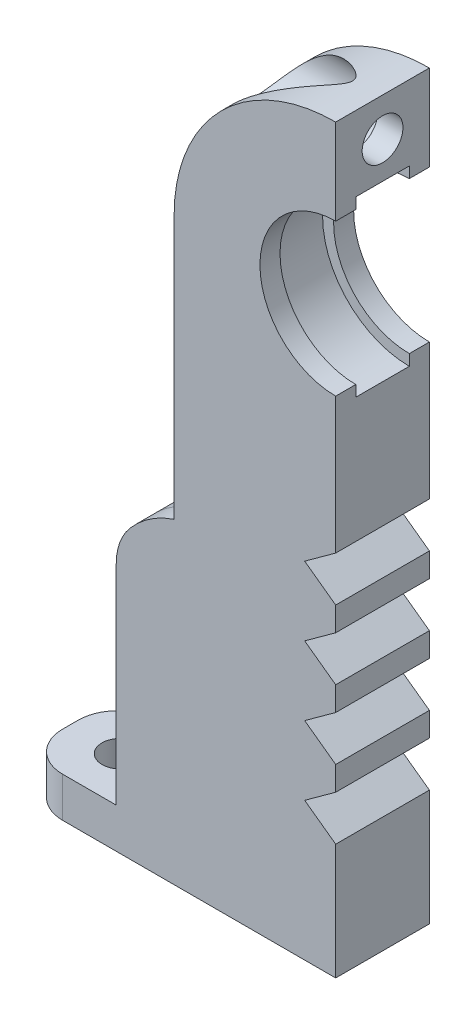
from build123d import *

# Parameters (mm, degrees)
BOSS_EXTRUDE1_DEPTH = 3.43
BOSS_EXTRUDE3_START = 2.57
BOSS_EXTRUDE3_DEPTH = 2.57
SKETCH6_R           = 2.41
CUT_EXTRUDE1_DEPTH  = 99.472542366
SKETCH7_R           = 2.61
CUT_EXTRUDE2_DEPTH  = 85.51564648
BOSS_EXTRUDE5_DEPTH = 2.57
FILLET4_R           = 5
SKETCH16_R          = 4.55
CUT_EXTRUDE5_DEPTH  = 84.028410807


with BuildPart() as part:
    # Sketch2 → Boss-Extrude1 (new, symmetric)
    with BuildSketch(Plane.XY):
        with BuildLine():
            Line((0, -11.11), (0, -27.11))
            Line((0, -27.11), (-3.97, -29.99))
            Line((-3.97, -29.99), (0, -32.87))
            Line((0, -32.87), (0, -35.95))
            Line((0, -35.95), (-3.97, -38.83))
            Line((-3.97, -38.83), (0, -41.71))
            Line((0, -41.71), (0, -44.79))
            Line((0, -44.79), (-3.97, -47.67))
            Line((-3.97, -47.67), (0, -50.55))
            Line((0, -50.55), (0, -53.63))
            Line((0, -53.63), (-3.97, -56.51))
            Line((-3.97, -56.51), (0, -59.39))
            Line((0, -59.39), (0, -74.23))
            Line((0, -74.23), (-39.96, -74.23))
            Line((-39.96, -74.23), (-39.96, -69.11))
            Line((-39.96, -69.11), (-28.1, -69.11))
            Line((-28.1, -69.11), (-28.1, -42.31))
            ThreePointArc((-28.1, -42.31), (-27.646434109, -39.757329931), (-26.341261949, -37.517157588))
            ThreePointArc((-26.341261949, -37.517157588), (-23.778435094, -35.222062226), (-20.69, -33.706439294))
            Line((-20.69, -33.706439294), (-20.69, 0))
            ThreePointArc((-20.69, 0), (-14.630039303, 14.630039303), (0, 20.69))
            Line((0, 20.69), (0, 11.11))
            ThreePointArc((0, 11.11), (-11.11, 0), (0, -11.11))
        make_face()
    extrude(amount=BOSS_EXTRUDE1_DEPTH, both=True)

    # Sketch4 → Boss-Extrude3 (add)
    with BuildSketch(Plane.XY.offset(3.43).offset(BOSS_EXTRUDE3_START)):
        with BuildLine():
            Line((-39.96, -69.11), (-39.96, -74.23))
            Line((-39.96, -74.23), (0, -74.23))
            Line((0, -74.23), (0, -59.39))
            Line((0, -59.39), (-3.97, -56.51))
            Line((-3.97, -56.51), (0, -53.63))
            Line((0, -53.63), (0, -50.55))
            Line((0, -50.55), (-3.97, -47.67))
            Line((-3.97, -47.67), (0, -44.79))
            Line((0, -44.79), (0, -41.71))
            Line((0, -41.71), (-3.97, -38.83))
            Line((-3.97, -38.83), (0, -35.95))
            Line((0, -35.95), (0, -32.87))
            Line((0, -32.87), (-3.97, -29.99))
            Line((-3.97, -29.99), (0, -27.11))
            Line((0, -27.11), (0, -9.7))
            ThreePointArc((0, -9.7), (-9.7, 0), (0, 9.7))
            Line((0, 9.7), (0, 20.69))
            ThreePointArc((0, 20.69), (-14.630039303, 14.630039303), (-20.69, 0))
            Line((-20.69, 0), (-20.69, -33.707281395))
            ThreePointArc((-20.69, -33.707281395), (-23.776797611, -35.221620619), (-26.33894333, -37.514425035))
            ThreePointArc((-26.33894333, -37.514425035), (-27.645816634, -39.755647839), (-28.1, -42.31))
            Line((-28.1, -42.31), (-28.1, -69.11))
            Line((-28.1, -69.11), (-39.96, -69.11))
        make_face()
    extrude(amount=-BOSS_EXTRUDE3_DEPTH)

    # Sketch6 → Cut-Extrude1 (cut, through all)
    with BuildSketch(Plane(origin=(0, -69.11, 0), x_dir=(1, 0, 0), z_dir=(0, 1, 0))):
        with Locations(Location((-33.51, 0, 0), (0, 0, 270))):
            Circle(SKETCH6_R)
    extrude(amount=-CUT_EXTRUDE1_DEPTH, mode=Mode.SUBTRACT)

    # Sketch7 → Cut-Extrude2 (cut, through all)
    with BuildSketch(Plane(origin=(0, 0, 0), x_dir=(0, 0, -1), z_dir=(1, 0, 0))):
        with Locations((0, 15.78)):
            Circle(SKETCH7_R)
    extrude(amount=-CUT_EXTRUDE2_DEPTH, mode=Mode.SUBTRACT)

    # Sketch15 → Boss-Extrude5 (add)
    with BuildSketch(Plane(origin=(0, 0, -3.43), x_dir=(-1, 0, 0), z_dir=(0, 0, -1))):
        with BuildLine():
            Line((0, 20.69), (0, 9.7))
            ThreePointArc((0, 9.7), (9.7, 0), (0, -9.7))
            Line((0, -9.7), (0, -27.11))
            Line((0, -27.11), (3.97, -29.99))
            Line((3.97, -29.99), (0, -32.87))
            Line((0, -32.87), (0, -35.95))
            Line((0, -35.95), (3.97, -38.83))
            Line((3.97, -38.83), (0, -41.71))
            Line((0, -41.71), (0, -44.79))
            Line((0, -44.79), (3.97, -47.67))
            Line((3.97, -47.67), (0, -50.55))
            Line((0, -50.55), (0, -53.63))
            Line((0, -53.63), (3.97, -56.51))
            Line((3.97, -56.51), (0, -59.39))
            Line((0, -59.39), (0, -74.23))
            Line((0, -74.23), (39.96, -74.23))
            Line((39.96, -74.23), (39.96, -69.11))
            Line((39.96, -69.11), (28.1, -69.11))
            Line((28.1, -69.11), (28.1, -42.31))
            ThreePointArc((28.1, -42.31), (27.645816634, -39.755647839), (26.33894333, -37.514425035))
            ThreePointArc((26.33894333, -37.514425035), (23.776756199, -35.221347075), (20.69, -33.706439294))
            Line((20.69, -33.706439294), (20.69, 0))
            ThreePointArc((20.69, 0), (14.630039303, 14.630039303), (0, 20.69))
        make_face()
    extrude(amount=BOSS_EXTRUDE5_DEPTH)

    # Fillet4
    fillet4_edges = [part.edges().sort_by_distance(p)[0] for p in [
        (-39.96, -71.67, -6),
        (-39.96, -71.67, 6),
    ]]
    fillet(fillet4_edges, radius=FILLET4_R)

    # Sketch16 → Cut-Extrude5 (cut, through all)
    with BuildSketch(Plane(origin=(-3.25, 0, 0), x_dir=(0, 0, -1), z_dir=(1, 0, 0))):
        with Locations((0, 15.78)):
            Circle(SKETCH16_R)
    extrude(amount=-CUT_EXTRUDE5_DEPTH, mode=Mode.SUBTRACT)


solid = part.part
